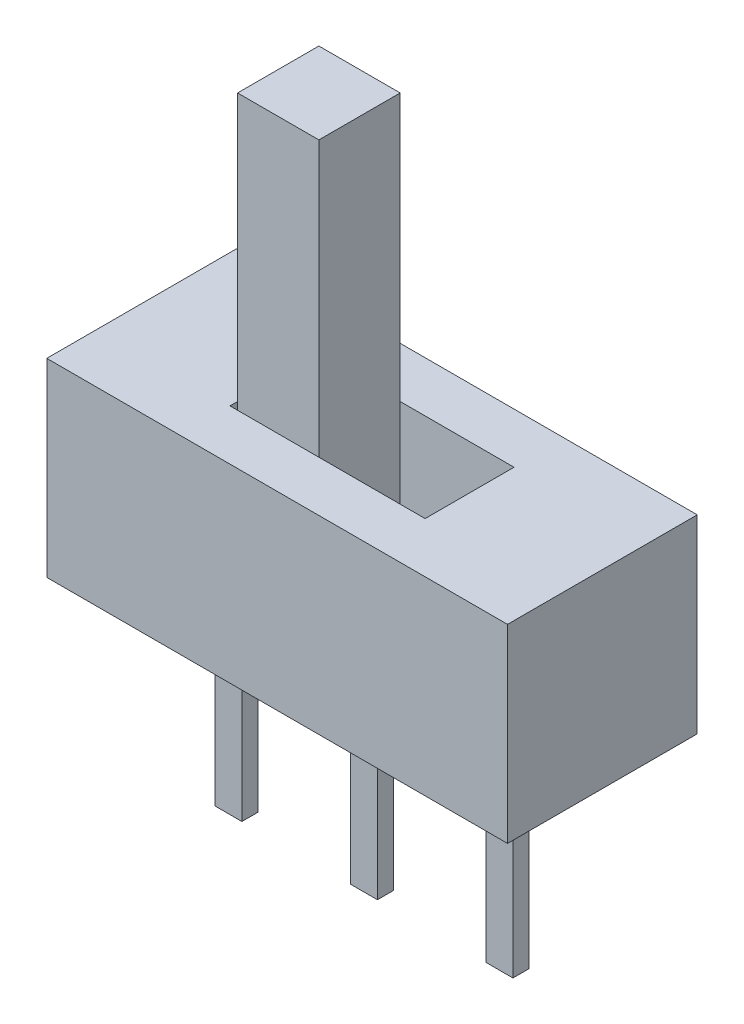
from build123d import *

# Parameters (mm, degrees)
SKETCH1_W           = 8.5
SKETCH1_H           = 3.5
BOSS_EXTRUDE1_DEPTH = 3.5
SKETCH2_W           = 3.6
SKETCH2_H           = 1.64
CUT_EXTRUDE1_DEPTH  = 2
SKETCH3_W           = 1.5
SKETCH3_H           = 1.5
BOSS_EXTRUDE3_DEPTH = 7
SKETCH4_W           = 0.5
SKETCH4_H           = 0.3
BOSS_EXTRUDE4_DEPTH = 3.7
LPATTERN1_COUNT     = 2
LPATTERN1_PITCH     = 2.5
LPATTERN1_COL_COUNT = 2
LPATTERN1_COL_PITCH = 2.5


with BuildPart() as part:
    # Sketch1 → Boss-Extrude1 (new body)
    with BuildSketch(Plane(origin=(0, 0, 0), x_dir=(1, 0, 0), z_dir=(0, 1, 0))):
        Rectangle(SKETCH1_W, SKETCH1_H)
    extrude(amount=BOSS_EXTRUDE1_DEPTH)

    # Sketch2 → Cut-Extrude1 (cut)
    with BuildSketch(Plane(origin=(0, 3.5, 0), x_dir=(1, 0, 0), z_dir=(0, 1, 0))):
        Rectangle(SKETCH2_W, SKETCH2_H)
    extrude(amount=-CUT_EXTRUDE1_DEPTH, mode=Mode.SUBTRACT)

    # Sketch3 → Boss-Extrude3 (add)
    with BuildSketch(Plane(origin=(0, 1.5, 0), x_dir=(1, 0, 0), z_dir=(0, 1, 0))):
        with Locations((-0.98, 0)):
            Rectangle(SKETCH3_W, SKETCH3_H)
    extrude(amount=BOSS_EXTRUDE3_DEPTH)

    # Sketch4 → Boss-Extrude4 (add)
    with BuildSketch(Plane.XZ):
        Rectangle(SKETCH4_W, SKETCH4_H)
    boss_extrude4 = extrude(amount=BOSS_EXTRUDE4_DEPTH)

    # LPattern1: Boss-Extrude4 ×2
    with Locations(*[(i * LPATTERN1_PITCH, 0, 0) for i in range(1, LPATTERN1_COUNT)]):
        add(boss_extrude4)

    # LPattern1 col: Boss-Extrude4 ×2
    with Locations(*[(-i * LPATTERN1_COL_PITCH, 0, 0) for i in range(1, LPATTERN1_COL_COUNT)]):
        add(boss_extrude4)


solid = part.part
